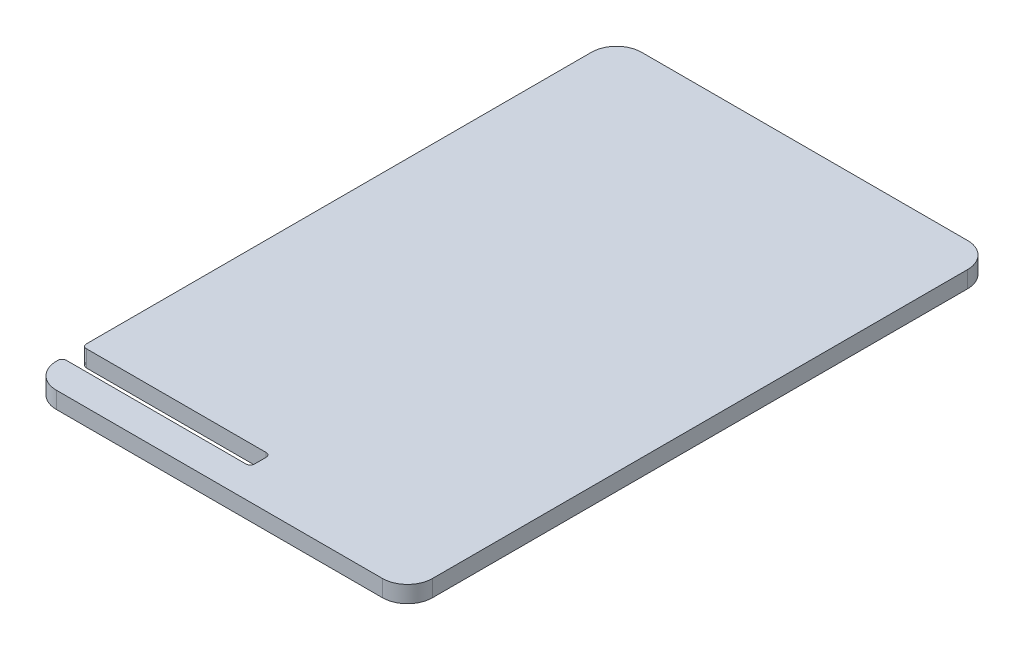
from build123d import *

# Parameters (mm, degrees)
CROQUIS1_W              = 45
CROQUIS1_H              = 70
SALIENTE_EXTRUIR1_DEPTH = 2
CROQUIS2_W              = 22.5
CROQUIS2_H              = 2.4
CORTAR_EXTRUIR1_DEPTH   = 2
REDONDEO1_R             = 3
REDONDEO2_R             = 0.5


with BuildPart() as part:
    # Croquis1 → Saliente-Extruir1 (new body)
    with BuildSketch(Plane(origin=(0, 0, 0), x_dir=(1, 0, 0), z_dir=(0, 1, 0))):
        with Locations((0, 0.306231574)):
            Rectangle(CROQUIS1_W, CROQUIS1_H)
    extrude(amount=SALIENTE_EXTRUIR1_DEPTH)

    # Croquis2 → Cortar-Extruir1 (cut)
    with BuildSketch(Plane(origin=(0, 2, 0), x_dir=(1, 0, 0), z_dir=(0, 1, 0))):
        with Locations((-11.25, -29.8)):
            Rectangle(CROQUIS2_W, CROQUIS2_H)
    extrude(amount=-CORTAR_EXTRUIR1_DEPTH, mode=Mode.SUBTRACT)

    # Redondeo1
    redondeo1_edges = [part.edges().sort_by_distance(p)[0] for p in [
        (-22.5, 1, -35.306231574),
        (22.5, 1, -35.306231574),
        (22.5, 1, 34.693768426),
        (-22.5, 1, 34.693768426),
    ]]
    fillet(redondeo1_edges, radius=REDONDEO1_R)

    # Redondeo2
    redondeo2_edges = [part.edges().sort_by_distance(p)[0] for p in [
        (-22.5, 1, 31),
        (-22.5, 1, 28.6),
        (0, 1, 28.6),
        (0, 1, 31),
    ]]
    fillet(redondeo2_edges, radius=REDONDEO2_R)


solid = part.part
